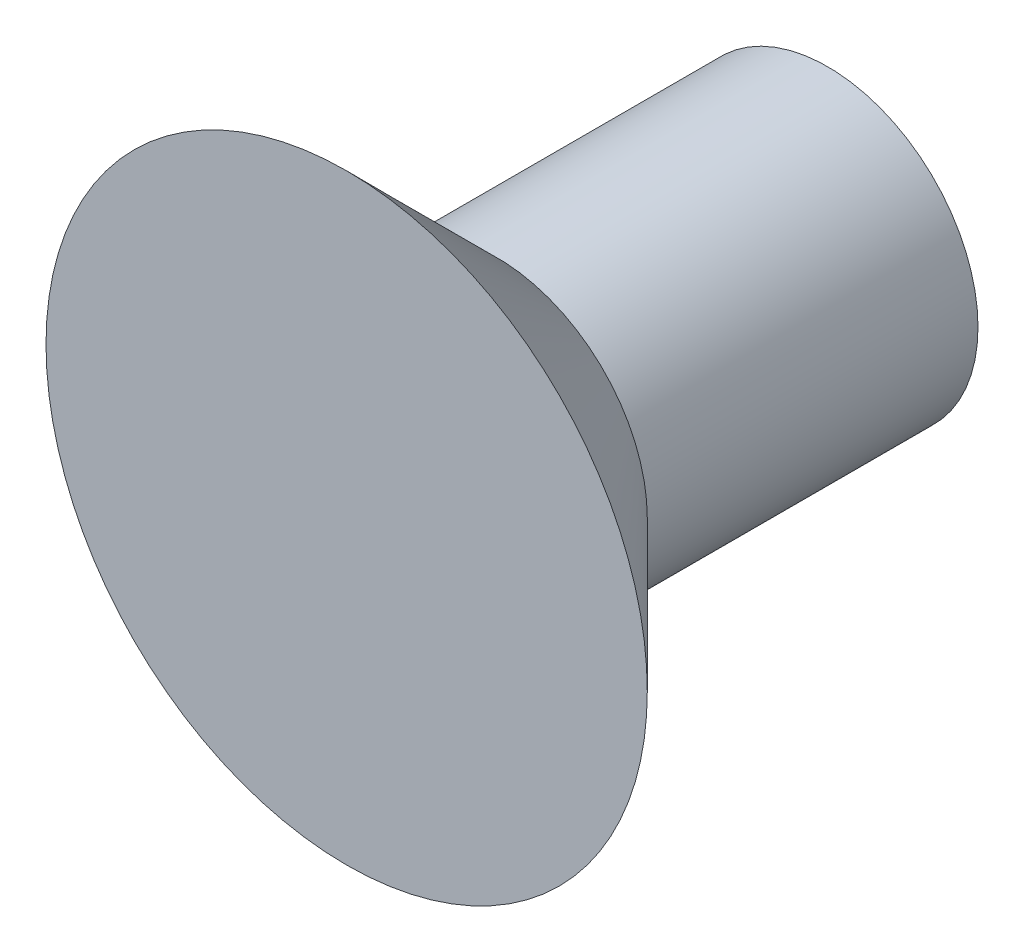
from build123d import *

# Parameters (mm, degrees)
SKETCH1_R                  = 2.5
COUNTERSUNK_HEAD_D5_DEPTH  = 1.25
COUNTERSUNK_HEAD_D5_DRAFT  = -45
M2P5_THREAD_ENVELOPE_START = -4
SKETCH2_R                  = 1.25
M2P5_THREAD_ENVELOPE_DEPTH = 2.75


with BuildPart() as part:
    # Sketch1 → Countersunk_Head_D5 (with draft: the straight prism first)
    with BuildSketch(Plane.XY):
        Circle(SKETCH1_R)
    extrude(amount=-COUNTERSUNK_HEAD_D5_DEPTH)
    # Countersunk_Head_D5: the draft: its side faces are tilted about the plane it starts from
    countersunk_head_d5_sides = [part.faces().sort_by_distance(p)[0] for p in [
        (-2.5, 0, -0.625),
    ]]
    draft(countersunk_head_d5_sides, Plane.XY, COUNTERSUNK_HEAD_D5_DRAFT)

    # Sketch2 → M2p5_Thread_Envelope (add)
    with BuildSketch(Plane.XY.offset(M2P5_THREAD_ENVELOPE_START)):
        Circle(SKETCH2_R)
    extrude(amount=M2P5_THREAD_ENVELOPE_DEPTH)


solid = part.part
